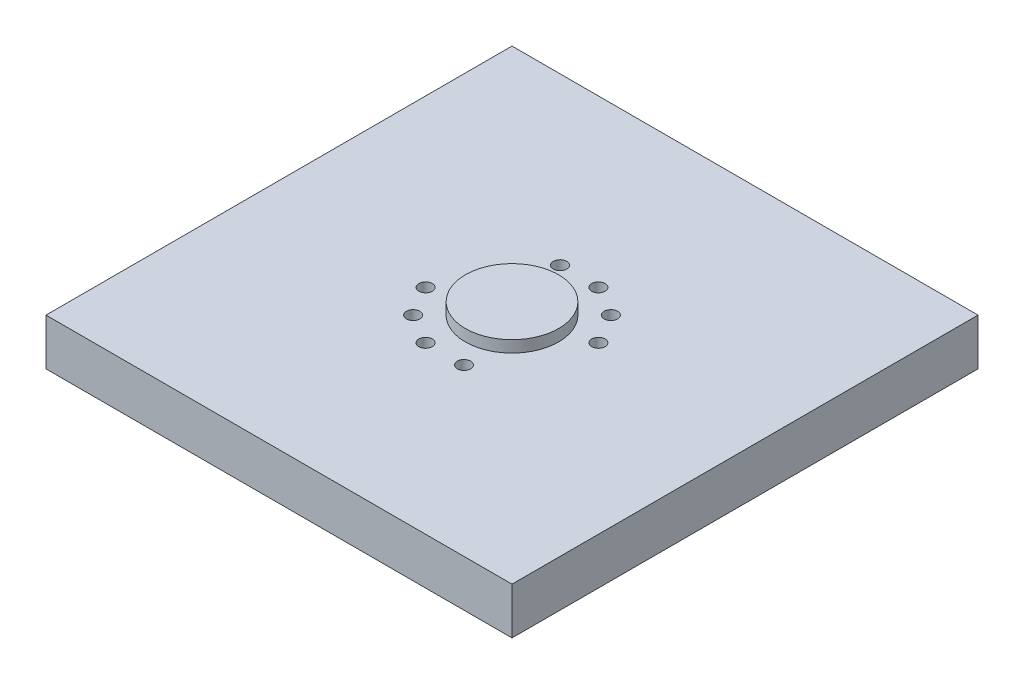
from build123d import *

# Parameters (mm, degrees)
SKETCH3_W           = 127
SKETCH3_H           = 127
BOSS_EXTRUDE1_DEPTH = 15.875
SKETCH4_W           = 127
SKETCH4_H           = 127
SKETCH4_R           = 12.7
CUT_EXTRUDE1_DEPTH  = 3.175
CUT_EXTRUDE2_REACH  = 182.054
SKETCH5_R           = 1.8288
CUT_EXTRUDE3_REACH  = 182.054
SKETCH9_R           = 1.8288
CUT_EXTRUDE4_REACH  = 182.054
SKETCH10_R          = 1.8288


with BuildPart() as part:
    # Sketch3 → Boss-Extrude1 (new body)
    with BuildSketch(Plane(origin=(0, 0, 0), x_dir=(1, 0, 0), z_dir=(0, 1, 0))):
        with Locations((63.5, 63.5)):
            Rectangle(SKETCH3_W, SKETCH3_H)
    extrude(amount=BOSS_EXTRUDE1_DEPTH)

    # Sketch4 → Cut-Extrude1 (cut)
    with BuildSketch(Plane(origin=(0, 15.875, 0), x_dir=(1, 0, 0), z_dir=(0, 1, 0))):
        with Locations((63.5, 63.5)):
            Rectangle(SKETCH4_W, SKETCH4_H)
        with Locations((63.5, 63.5)):
            Circle(SKETCH4_R, mode=Mode.SUBTRACT)
    extrude(amount=-CUT_EXTRUDE1_DEPTH, mode=Mode.SUBTRACT)

    # Sketch5 → Cut-Extrude2 (cut, up to next)
    with BuildSketch(Plane(origin=(0, 12.7, 0), x_dir=(1, 0, 0), z_dir=(0, 1, 0)), mode=Mode.PRIVATE) as cut_extrude2_sk1:
        with Locations((45.182968797, 58.266562514)):
            Circle(SKETCH5_R)
    cut_extrude2_tool1 = extrude(cut_extrude2_sk1.sketch, amount=-CUT_EXTRUDE2_REACH, mode=Mode.PRIVATE) & part.part
    # Sketch5 → Cut-Extrude2 (cut, up to next)
    with BuildSketch(Plane(origin=(0, 12.7, 0), x_dir=(1, 0, 0), z_dir=(0, 1, 0)), mode=Mode.PRIVATE) as cut_extrude2_sk2:
        with Locations((68.733437486, 45.182968797)):
            Circle(SKETCH5_R)
    cut_extrude2_tool2 = extrude(cut_extrude2_sk2.sketch, amount=-CUT_EXTRUDE2_REACH, mode=Mode.PRIVATE) & part.part
    # Sketch5 → Cut-Extrude2 (cut, up to next)
    with BuildSketch(Plane(origin=(0, 12.7, 0), x_dir=(1, 0, 0), z_dir=(0, 1, 0)), mode=Mode.PRIVATE) as cut_extrude2_sk3:
        with Locations((81.817031203, 68.733437486)):
            Circle(SKETCH5_R)
    cut_extrude2_tool3 = extrude(cut_extrude2_sk3.sketch, amount=-CUT_EXTRUDE2_REACH, mode=Mode.PRIVATE) & part.part
    # Sketch5 → Cut-Extrude2 (cut, up to next)
    with BuildSketch(Plane(origin=(0, 12.7, 0), x_dir=(1, 0, 0), z_dir=(0, 1, 0)), mode=Mode.PRIVATE) as cut_extrude2_sk4:
        with Locations((58.266562514, 81.817031203)):
            Circle(SKETCH5_R)
    cut_extrude2_tool4 = extrude(cut_extrude2_sk4.sketch, amount=-CUT_EXTRUDE2_REACH, mode=Mode.PRIVATE) & part.part
    add(cut_extrude2_tool1.solids().sort_by_distance((45.182969, 12.7, -58.266563))[0], mode=Mode.SUBTRACT)
    add(cut_extrude2_tool2.solids().sort_by_distance((68.733437, 12.7, -45.182969))[0], mode=Mode.SUBTRACT)
    add(cut_extrude2_tool3.solids().sort_by_distance((81.817031, 12.7, -68.733437))[0], mode=Mode.SUBTRACT)
    add(cut_extrude2_tool4.solids().sort_by_distance((58.266563, 12.7, -81.817031))[0], mode=Mode.SUBTRACT)

    # Sketch9 → Cut-Extrude3 (cut, up to next)
    with BuildSketch(Plane(origin=(0, 12.7, 0), x_dir=(1, 0, 0), z_dir=(0, 1, 0)), mode=Mode.PRIVATE) as cut_extrude3_sk1:
        with Locations((68.733437486, 81.817031203)):
            Circle(SKETCH9_R)
    cut_extrude3_tool1 = extrude(cut_extrude3_sk1.sketch, amount=-CUT_EXTRUDE3_REACH, mode=Mode.PRIVATE) & part.part
    # Sketch9 → Cut-Extrude3 (cut, up to next)
    with BuildSketch(Plane(origin=(0, 12.7, 0), x_dir=(1, 0, 0), z_dir=(0, 1, 0)), mode=Mode.PRIVATE) as cut_extrude3_sk2:
        with Locations((58.266562514, 45.182968797)):
            Circle(SKETCH9_R)
    cut_extrude3_tool2 = extrude(cut_extrude3_sk2.sketch, amount=-CUT_EXTRUDE3_REACH, mode=Mode.PRIVATE) & part.part
    add(cut_extrude3_tool1.solids().sort_by_distance((68.733437, 12.7, -81.817031))[0], mode=Mode.SUBTRACT)
    add(cut_extrude3_tool2.solids().sort_by_distance((58.266563, 12.7, -45.182969))[0], mode=Mode.SUBTRACT)

    # Sketch10 → Cut-Extrude4 (cut, up to next)
    with BuildSketch(Plane(origin=(0, 12.7, 0), x_dir=(1, 0, 0), z_dir=(0, 1, 0)), mode=Mode.PRIVATE) as cut_extrude4_sk1:
        with Locations((76.970384182, 76.970384182)):
            Circle(SKETCH10_R)
    cut_extrude4_tool1 = extrude(cut_extrude4_sk1.sketch, amount=-CUT_EXTRUDE4_REACH, mode=Mode.PRIVATE) & part.part
    # Sketch10 → Cut-Extrude4 (cut, up to next)
    with BuildSketch(Plane(origin=(0, 12.7, 0), x_dir=(1, 0, 0), z_dir=(0, 1, 0)), mode=Mode.PRIVATE) as cut_extrude4_sk2:
        with Locations((50.029615818, 50.029615818)):
            Circle(SKETCH10_R)
    cut_extrude4_tool2 = extrude(cut_extrude4_sk2.sketch, amount=-CUT_EXTRUDE4_REACH, mode=Mode.PRIVATE) & part.part
    add(cut_extrude4_tool1.solids().sort_by_distance((76.970384, 12.7, -76.970384))[0], mode=Mode.SUBTRACT)
    add(cut_extrude4_tool2.solids().sort_by_distance((50.029616, 12.7, -50.029616))[0], mode=Mode.SUBTRACT)


solid = part.part
